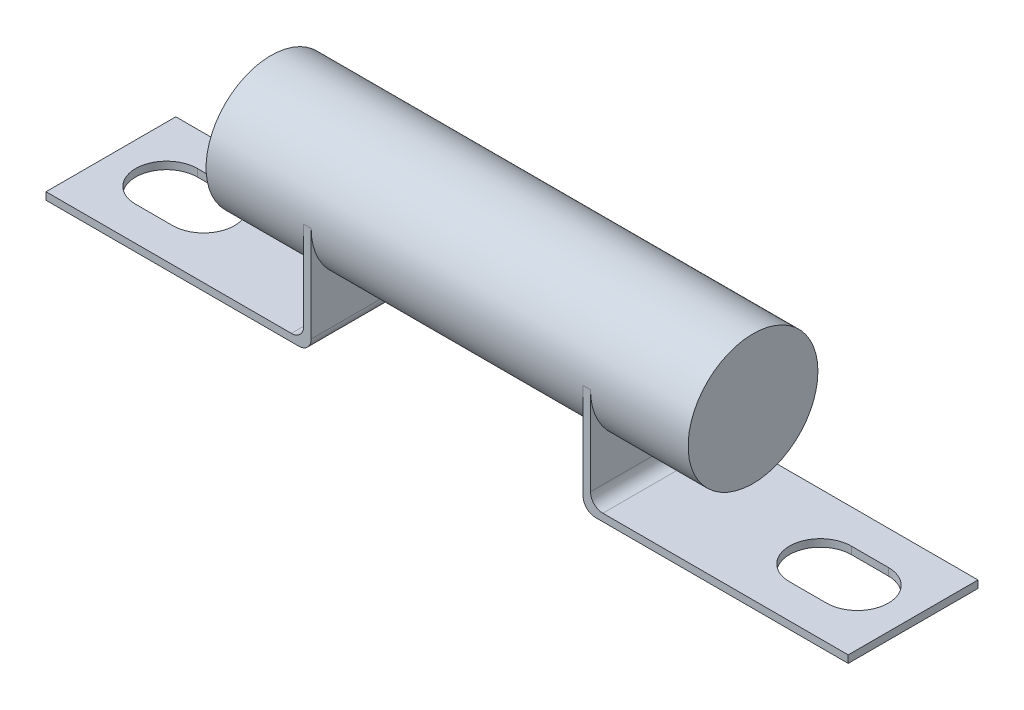
from build123d import *

# Parameters (mm, degrees)
SKETCH1_R           = 5.25
BOSS_EXTRUDE1_DEPTH = 19.5
BOSS_EXTRUDE2_DEPTH = 10.5
FILLET1_R           = 1
CUT_EXTRUDE1_DEPTH  = 0.6


with BuildPart() as part:
    # Sketch1 → Boss-Extrude1 (new, symmetric)
    with BuildSketch(Plane(origin=(0, 0, 0), x_dir=(0, 0, -1), z_dir=(1, 0, 0))):
        Circle(SKETCH1_R)
    extrude(amount=BOSS_EXTRUDE1_DEPTH, both=True)

    # Sketch2 → Boss-Extrude2 (add)
    with BuildSketch(Plane.XY.offset(5.25)):
        Polygon((-32.45, -8.15), (-11.6, -8.15), (-11.6, 0), (-11, 0), (-11, -8.75), (-32.45, -8.75), align=None)
        Polygon((32.45, -8.15), (11.6, -8.15), (11.6, 0), (11, 0), (11, -8.75), (32.45, -8.75), align=None)
    extrude(amount=-BOSS_EXTRUDE2_DEPTH)

    # Fillet1
    fillet1_edges = [part.edges().sort_by_distance(p)[0] for p in [
        (-11, -8.75, 0),
        (-11.6, -8.15, 0),
        (11.6, -8.15, 0),
        (11, -8.75, 0),
    ]]
    fillet(fillet1_edges, radius=FILLET1_R)

    # Sketch3 → Cut-Extrude1 (cut)
    with BuildSketch(Plane(origin=(0, -8.15, 0), x_dir=(1, 0, 0), z_dir=(0, 1, 0))):
        with BuildLine():
            Line((-24.95, -2.5), (-27.95, -2.5))
            ThreePointArc((-27.95, -2.5), (-30.45, 0), (-27.95, 2.5))
            Line((-27.95, 2.5), (-24.95, 2.5))
            ThreePointArc((-24.95, 2.5), (-22.45, 0), (-24.95, -2.5))
        make_face()
        with BuildLine():
            Line((24.95, -2.5), (27.95, -2.5))
            ThreePointArc((27.95, -2.5), (30.45, 0), (27.95, 2.5))
            Line((27.95, 2.5), (24.95, 2.5))
            ThreePointArc((24.95, 2.5), (22.45, 0), (24.95, -2.5))
        make_face()
    extrude(amount=-CUT_EXTRUDE1_DEPTH, mode=Mode.SUBTRACT)


solid = part.part
